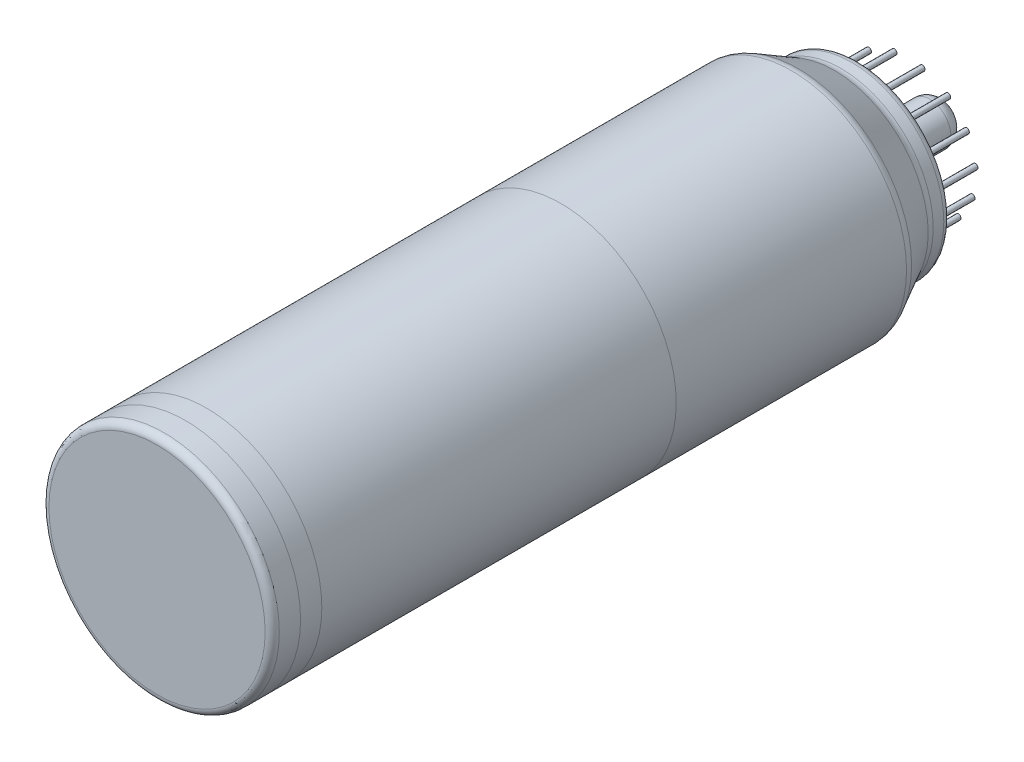
from build123d import *

# Parameters (mm, degrees)
FILLET1_R           = 1
FILLET2_R           = 2
SKETCH2_R           = 0.375
BOSS_EXTRUDE1_DEPTH = 7
CIRPATTERN1_COUNT   = 14
CIRPATTERN1_ANGLE   = 312


with BuildPart() as part:
    # Sketch1 → Revolve1 (revolve)
    with BuildSketch(Plane(origin=(0, 0, 0), x_dir=(0, 0, -1), z_dir=(1, 0, 0)), mode=Mode.PRIVATE) as revolve1_sk:
        Polygon((0, 0), (0, 16.25), (90, 16.25), (96, 13), (99, 13), (99, 3), (111, 3), (111, 0), align=None)
    revolve(revolve1_sk.sketch.rotate(Axis((0, 0, -111), (0, 0, -1)), 90), axis=Axis((0, 0, -111), (0, 0, -1)))

    # Fillet1
    fillet1_edges = [part.edges().sort_by_distance(p)[0] for p in [
        (-13, 0, -99),
        (-16.25, 0, 0),
    ]]
    fillet(fillet1_edges, radius=FILLET1_R)

    # Fillet2
    fillet2_edges = [part.edges().sort_by_distance(p)[0] for p in [
        (-3, 0, -111),
        (-3, 0, -99),
        (-13, 0, -96),
        (-16.25, 0, -90),
    ]]
    fillet(fillet2_edges, radius=FILLET2_R)

    # Sketch2 → Boss-Extrude1 (add)
    with BuildSketch(Plane(origin=(0, 0, -99), x_dir=(-1, 0, 0), z_dir=(0, 0, -1))):
        with Locations(Location((3.863998109, -8.678681848, 0), (0, 0, 180))):
            Circle(SKETCH2_R)
    boss_extrude1 = extrude(amount=BOSS_EXTRUDE1_DEPTH)

    # CirPattern1: Boss-Extrude1 ×14 about axis
    cirpattern1_axis = Axis((0, 0, 0), (0, 0, -1))
    for i in range(1, CIRPATTERN1_COUNT):
        add(boss_extrude1.rotate(cirpattern1_axis, i * CIRPATTERN1_ANGLE / (CIRPATTERN1_COUNT - 1)))


solid = part.part
